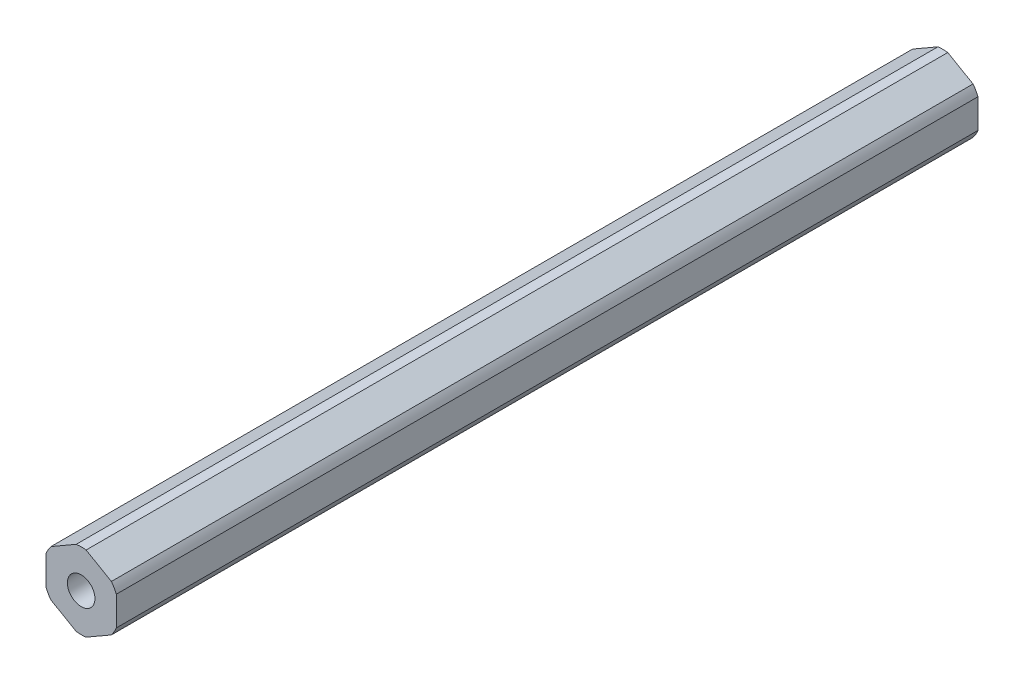
from build123d import *

# Parameters (mm, degrees)
SKETCH2_R           = 2.4892
BOSS_EXTRUDE1_DEPTH = 155.575


with BuildPart() as part:
    # Sketch2 → Boss-Extrude1 (new body)
    with BuildSketch(Plane.XY):
        with BuildLine():
            Line((-0.893039494, 6.816751826), (-5.456960506, 4.181770802))
            ThreePointArc((-5.456960506, 4.181770802), (-5.953924651, 3.4375), (-6.35, 2.634981025))
            Line((-6.35, 2.634981025), (-6.35, -2.634981025))
            ThreePointArc((-6.35, -2.634981025), (-5.953924651, -3.4375), (-5.456960506, -4.181770802))
            Line((-5.456960506, -4.181770802), (-0.893039494, -6.816751826))
            ThreePointArc((-0.893039494, -6.816751826), (0, -6.875), (0.893039494, -6.816751826))
            Line((0.893039494, -6.816751826), (5.456960506, -4.181770802))
            ThreePointArc((5.456960506, -4.181770802), (5.953924651, -3.4375), (6.35, -2.634981025))
            Line((6.35, -2.634981025), (6.35, 2.634981025))
            ThreePointArc((6.35, 2.634981025), (5.953924651, 3.4375), (5.456960506, 4.181770802))
            Line((5.456960506, 4.181770802), (0.893039494, 6.816751826))
            ThreePointArc((0.893039494, 6.816751826), (0, 6.875), (-0.893039494, 6.816751826))
        make_face()
        Circle(SKETCH2_R, mode=Mode.SUBTRACT)
    extrude(amount=-BOSS_EXTRUDE1_DEPTH)


solid = part.part
